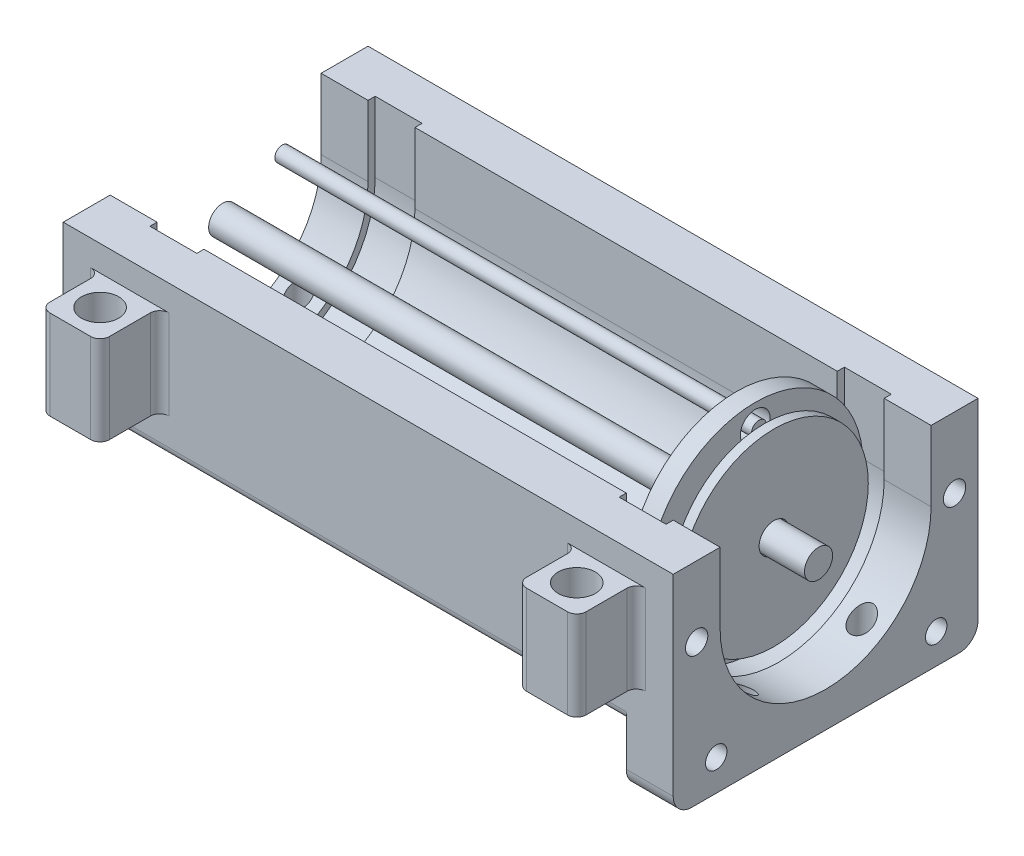
from build123d import *

# Parameters (mm, degrees)
SKETCH1_R             = 2.38125
BOSS_EXTRUDE1_DEPTH   = 45
SKETCH3_R             = 23
SKETCH3_R_2           = 3.175
BOSS_EXTRUDE2_DEPTH   = 4
SKETCH17_R            = 20.1
SKETCH17_R_2          = 3.175
BOSS_EXTRUDE4_DEPTH   = 2
SKETCH19_R            = 3
BOSS_EXTRUDE6_DEPTH   = 63.5
SKETCH20_R            = 1.5875
BOSS_EXTRUDE7_DEPTH   = 50.8
BOSS_EXTRUDE7_2_DEPTH = 50.8
BOSS_EXTRUDE7_3_DEPTH = 50.8
BOSS_EXTRUDE7_4_DEPTH = 50.8
BOSS_EXTRUDE8_START   = 10
SKETCH21_R            = 2.38125
BOSS_EXTRUDE8_DEPTH   = 10
BOSS_EXTRUDE9_START   = 10
SKETCH23_R            = 2.38125
SKETCH23_R_2          = 2.286
BOSS_EXTRUDE9_DEPTH   = 10
SKETCH24_R            = 2.38125
CUT_EXTRUDE1_DEPTH    = 50
SKETCH25_R            = 2.38125
BOSS_EXTRUDE10_DEPTH  = 10
SKETCH27_R            = 2.38125
BOSS_EXTRUDE11_DEPTH  = 10
SKETCH29_W            = 12.7
SKETCH29_H            = 19.05
BOSS_EXTRUDE12_DEPTH  = 12.7
SKETCH30_R            = 3.96875
CUT_EXTRUDE2_DEPTH    = 40
FILLET1_R             = 2


with BuildPart() as part:
    # Sketch1 → Boss-Extrude1 (new, symmetric)
    with BuildSketch(Plane(origin=(0, 0, 0), x_dir=(0, 0, -1), z_dir=(1, 0, 0))):
        with BuildLine():
            Line((-22.48125, 0), (-22.48125, 15))
            Line((-22.48125, 15), (-32.48125, 15))
            Line((-32.48125, 15), (-32.48125, -15.371))
            ThreePointArc((-32.48125, -15.371), (-31.895463562, -16.785213562), (-30.48125, -17.371))
            Line((-30.48125, -17.371), (-23.31225, -17.371))
            ThreePointArc((-23.31225, -17.371), (-19.069609313, -19.128359313), (-17.31225, -23.371))
            Line((-17.31225, -23.371), (-17.31225, -28))
            ThreePointArc((-17.31225, -28), (-16.726463562, -29.414213562), (-15.31225, -30))
            Line((-15.31225, -30), (15.42975, -30))
            ThreePointArc((15.42975, -30), (16.843963562, -29.414213562), (17.42975, -28))
            Line((17.42975, -28), (17.42975, -23.371))
            ThreePointArc((17.42975, -23.371), (19.187109313, -19.128359313), (23.42975, -17.371))
            Line((23.42975, -17.371), (30.05875, -17.371))
            Line((30.05875, -17.371), (30.48125, -17.371))
            ThreePointArc((30.48125, -17.371), (31.895463562, -16.785213562), (32.48125, -15.371))
            Line((32.48125, -15.371), (32.48125, 15))
            Line((32.48125, 15), (22.48125, 15))
            Line((22.48125, 15), (22.48125, 0))
            ThreePointArc((22.48125, 0), (0, -22.48125), (-22.48125, 0))
        make_face()
        with Locations(Location((-27.48125, 0, 0), (0, 0, 180))):
            Circle(SKETCH1_R, mode=Mode.SUBTRACT)
        with Locations(Location((27.48125, 0, 0), (0, 0, 180))):
            Circle(SKETCH1_R, mode=Mode.SUBTRACT)
    extrude(amount=BOSS_EXTRUDE1_DEPTH, both=True)

    # Sketch21 → Boss-Extrude8 (add)
    with BuildSketch(Plane(origin=(45, 0, 0), x_dir=(0, 0, -1), z_dir=(1, 0, 0)).offset(BOSS_EXTRUDE8_START)):
        with BuildLine():
            Line((-24, 0), (-24, 15))
            Line((-24, 15), (-32.48125, 15))
            Line((-32.48125, 15), (-32.48125, -15.371))
            ThreePointArc((-32.48125, -15.371), (-31.895463562, -16.785213562), (-30.48125, -17.371))
            Line((-30.48125, -17.371), (-23.31225, -17.371))
            ThreePointArc((-23.31225, -17.371), (-19.069609313, -19.128359313), (-17.31225, -23.371))
            Line((-17.31225, -23.371), (-17.31225, -28))
            ThreePointArc((-17.31225, -28), (-16.726463562, -29.414213562), (-15.31225, -30))
            Line((-15.31225, -30), (15.42975, -30))
            ThreePointArc((15.42975, -30), (16.843963562, -29.414213562), (17.42975, -28))
            Line((17.42975, -28), (17.42975, -23.371))
            ThreePointArc((17.42975, -23.371), (19.187109313, -19.128359313), (23.42975, -17.371))
            Line((23.42975, -17.371), (30.05875, -17.371))
            Line((30.05875, -17.371), (30.48125, -17.371))
            ThreePointArc((30.48125, -17.371), (31.895463562, -16.785213562), (32.48125, -15.371))
            Line((32.48125, -15.371), (32.48125, 15))
            Line((32.48125, 15), (24, 15))
            Line((24, 15), (24, 0))
            ThreePointArc((24, 0), (0, -24), (-24, 0))
        make_face()
        with Locations(Location((-27.48125, 0, 0), (0, 0, 180))):
            Circle(SKETCH21_R, mode=Mode.SUBTRACT)
        with Locations(Location((27.48125, 0, 0), (0, 0, 180))):
            Circle(SKETCH21_R, mode=Mode.SUBTRACT)
    extrude(amount=-BOSS_EXTRUDE8_DEPTH)

    # Sketch23 → Boss-Extrude9 (add)
    with BuildSketch(Plane(origin=(55, 0, 0), x_dir=(0, 0, -1), z_dir=(1, 0, 0)).offset(BOSS_EXTRUDE9_START)):
        with BuildLine():
            Line((-22.48125, 0), (-22.48125, 15))
            Line((-22.48125, 15), (-32.48125, 15))
            Line((-32.48125, 15), (-32.48125, -26))
            ThreePointArc((-32.48125, -26), (-31.309677125, -28.828427125), (-28.48125, -30))
            Line((-28.48125, -30), (28.48125, -30))
            ThreePointArc((28.48125, -30), (31.309677125, -28.828427125), (32.48125, -26))
            Line((32.48125, -26), (32.48125, 15))
            Line((32.48125, 15), (22.48125, 15))
            Line((22.48125, 15), (22.48125, 0))
            ThreePointArc((22.48125, 0), (0, -22.48125), (-22.48125, 0))
        make_face()
        with Locations(Location((-27.48125, 0, 0), (0, 0, 180))):
            Circle(SKETCH23_R, mode=Mode.SUBTRACT)
        with Locations(Location((27.48125, 0, 0), (0, 0, 180))):
            Circle(SKETCH23_R, mode=Mode.SUBTRACT)
        with Locations((-23.31225, -23.371)):
            Circle(SKETCH23_R_2, mode=Mode.SUBTRACT)
        with Locations((23.5712, -23.5712)):
            Circle(SKETCH23_R_2, mode=Mode.SUBTRACT)
    extrude(amount=-BOSS_EXTRUDE9_DEPTH)

    # Sketch24 → Cut-Extrude1 (cut)
    with BuildSketch(Plane.XZ.offset(30)):
        with Locations(Location((60, 12.7, 0), (0, 0, 270))):
            Circle(SKETCH24_R)
        with Locations(Location((60, -12.7, 0), (0, 0, 270))):
            Circle(SKETCH24_R)
    cut_extrude1 = extrude(amount=-CUT_EXTRUDE1_DEPTH, mode=Mode.SUBTRACT)

    # Sketch25 → Boss-Extrude10 (add)
    with BuildSketch(Plane.ZY.offset(45)):
        with BuildLine():
            Line((-24, 0), (-24, 15))
            Line((-24, 15), (-32.48125, 15))
            Line((-32.48125, 15), (-32.48125, -15.371))
            ThreePointArc((-32.48125, -15.371), (-31.895463562, -16.785213562), (-30.48125, -17.371))
            Line((-30.48125, -17.371), (-23.31225, -17.371))
            ThreePointArc((-23.31225, -17.371), (-19.069609313, -19.128359313), (-17.31225, -23.371))
            Line((-17.31225, -23.371), (-17.31225, -28))
            ThreePointArc((-17.31225, -28), (-16.726463562, -29.414213562), (-15.31225, -30))
            Line((-15.31225, -30), (15.42975, -30))
            ThreePointArc((15.42975, -30), (16.843963562, -29.414213562), (17.42975, -28))
            Line((17.42975, -28), (17.42975, -23.371))
            ThreePointArc((17.42975, -23.371), (19.187109313, -19.128359313), (23.42975, -17.371))
            Line((23.42975, -17.371), (30.05875, -17.371))
            Line((30.05875, -17.371), (30.48125, -17.371))
            ThreePointArc((30.48125, -17.371), (31.895463562, -16.785213562), (32.48125, -15.371))
            Line((32.48125, -15.371), (32.48125, 15))
            Line((32.48125, 15), (24, 15))
            Line((24, 15), (24, 0))
            ThreePointArc((24, 0), (0, -24), (-24, 0))
        make_face()
        with Locations((-27.48125, 0)):
            Circle(SKETCH25_R, mode=Mode.SUBTRACT)
        with Locations((27.48125, 0)):
            Circle(SKETCH25_R, mode=Mode.SUBTRACT)
    extrude(amount=BOSS_EXTRUDE10_DEPTH)

    # Sketch27 → Boss-Extrude11 (add)
    with BuildSketch(Plane.ZY.offset(55)):
        with BuildLine():
            Line((-22.48125, 0), (-22.48125, 15))
            Line((-22.48125, 15), (-32.48125, 15))
            Line((-32.48125, 15), (-32.48125, -15.371))
            ThreePointArc((-32.48125, -15.371), (-31.895463562, -16.785213562), (-30.48125, -17.371))
            Line((-30.48125, -17.371), (-23.31225, -17.371))
            ThreePointArc((-23.31225, -17.371), (-19.069609313, -19.128359313), (-17.31225, -23.371))
            Line((-17.31225, -23.371), (-17.31225, -28))
            ThreePointArc((-17.31225, -28), (-16.726463562, -29.414213562), (-15.31225, -30))
            Line((-15.31225, -30), (15.42975, -30))
            ThreePointArc((15.42975, -30), (16.843963562, -29.414213562), (17.42975, -28))
            Line((17.42975, -28), (17.42975, -23.371))
            ThreePointArc((17.42975, -23.371), (19.187109313, -19.128359313), (23.42975, -17.371))
            Line((23.42975, -17.371), (30.05875, -17.371))
            Line((30.05875, -17.371), (30.48125, -17.371))
            ThreePointArc((30.48125, -17.371), (31.895463562, -16.785213562), (32.48125, -15.371))
            Line((32.48125, -15.371), (32.48125, 15))
            Line((32.48125, 15), (22.48125, 15))
            Line((22.48125, 15), (22.48125, 0))
            ThreePointArc((22.48125, 0), (0, -22.48125), (-22.48125, 0))
        make_face()
        with Locations((-27.48125, 0)):
            Circle(SKETCH27_R, mode=Mode.SUBTRACT)
        with Locations((27.48125, 0)):
            Circle(SKETCH27_R, mode=Mode.SUBTRACT)
    extrude(amount=BOSS_EXTRUDE11_DEPTH)

    # Mirror6: Cut-Extrude1 across plane
    add(cut_extrude1.mirror(Plane(origin=(0, 0, 0), x_dir=(0, 0, 1), z_dir=(1, 0, 0))), mode=Mode.SUBTRACT)

    # Sketch29 → Boss-Extrude12 (add)
    with BuildSketch(Plane.XY.offset(32.48125)):
        with Locations((50.8, 0)):
            Rectangle(SKETCH29_W, SKETCH29_H)
    boss_extrude12 = extrude(amount=BOSS_EXTRUDE12_DEPTH)

    # Sketch30 → Cut-Extrude2 (cut)
    with BuildSketch(Plane(origin=(0, 9.525, 0), x_dir=(1, 0, 0), z_dir=(0, 1, 0))):
        with Locations(Location((50.8, -38.83125, 0), (0, 0, 270))):
            Circle(SKETCH30_R)
    cut_extrude2 = extrude(amount=-CUT_EXTRUDE2_DEPTH, mode=Mode.SUBTRACT)

    # Mirror7: Boss-Extrude12, Cut-Extrude2 across plane
    add(boss_extrude12.mirror(Plane(origin=(0, 0, 0), x_dir=(0, 0, 1), z_dir=(1, 0, 0))))
    add(cut_extrude2.mirror(Plane(origin=(0, 0, 0), x_dir=(0, 0, 1), z_dir=(1, 0, 0))), mode=Mode.SUBTRACT)

    # Fillet1
    fillet1_edges = [part.edges().sort_by_distance(p)[0] for p in [
        (57.15, 0, 45.18125),
        (44.45, 0, 32.48125),
        (44.45, 0, 45.18125),
        (57.15, 0, 32.48125),
        (-57.15, 0, 32.48125),
        (-44.45, 0, 45.18125),
        (-57.15, 0, 45.18125),
        (-44.45, 0, 32.48125),
    ]]
    fillet(fillet1_edges, radius=FILLET1_R)


with BuildPart() as body_2:
    # Sketch3 → Boss-Extrude2 (new body)
    with BuildSketch(Plane(origin=(46, 0, 0), x_dir=(0, 0, -1), z_dir=(1, 0, 0))):
        Circle(SKETCH3_R)
        Circle(SKETCH3_R_2, mode=Mode.SUBTRACT)
        with Locations((0, 18.5125)):
            Circle(SKETCH3_R_2, mode=Mode.SUBTRACT)
        with Locations((-18.5125, 0)):
            Circle(SKETCH3_R_2, mode=Mode.SUBTRACT)
        with Locations((0, -18.5125)):
            Circle(SKETCH3_R_2, mode=Mode.SUBTRACT)
        with Locations((18.5125, 0)):
            Circle(SKETCH3_R_2, mode=Mode.SUBTRACT)
    extrude(amount=BOSS_EXTRUDE2_DEPTH)


with BuildPart() as body_3:
    # Sketch17 → Boss-Extrude4 (new body)
    with BuildSketch(Plane(origin=(52, 0, 0), x_dir=(0, 0, -1), z_dir=(1, 0, 0))):
        Circle(SKETCH17_R)
        Circle(SKETCH17_R_2, mode=Mode.SUBTRACT)
    extrude(amount=BOSS_EXTRUDE4_DEPTH)


with BuildPart() as body_4:
    # Sketch19 → Boss-Extrude6 (new, symmetric)
    with BuildSketch(Plane(origin=(0, 0, 0), x_dir=(0, 0, -1), z_dir=(1, 0, 0))):
        Circle(SKETCH19_R)
    extrude(amount=BOSS_EXTRUDE6_DEPTH, both=True)


with BuildPart() as body_5:
    # Sketch20 → Boss-Extrude7 (new, symmetric)
    with BuildSketch(Plane(origin=(0, 0, 0), x_dir=(0, 0, -1), z_dir=(1, 0, 0))):
        with Locations((0, 18.5125)):
            Circle(SKETCH20_R)
    extrude(amount=BOSS_EXTRUDE7_DEPTH, both=True)


with BuildPart() as body_6:
    # Sketch20 → Boss-Extrude7 2 (new, symmetric)
    with BuildSketch(Plane(origin=(0, 0, 0), x_dir=(0, 0, -1), z_dir=(1, 0, 0))):
        with Locations((18.5125, 0)):
            Circle(SKETCH20_R)
    extrude(amount=BOSS_EXTRUDE7_2_DEPTH, both=True)


with BuildPart() as body_7:
    # Sketch20 → Boss-Extrude7 3 (new, symmetric)
    with BuildSketch(Plane(origin=(0, 0, 0), x_dir=(0, 0, -1), z_dir=(1, 0, 0))):
        with Locations((0, -18.5125)):
            Circle(SKETCH20_R)
    extrude(amount=BOSS_EXTRUDE7_3_DEPTH, both=True)


with BuildPart() as body_8:
    # Sketch20 → Boss-Extrude7 4 (new, symmetric)
    with BuildSketch(Plane(origin=(0, 0, 0), x_dir=(0, 0, -1), z_dir=(1, 0, 0))):
        with Locations((-18.5125, 0)):
            Circle(SKETCH20_R)
    extrude(amount=BOSS_EXTRUDE7_4_DEPTH, both=True)


solid = Compound([part.part, body_2.part, body_3.part, body_4.part, body_5.part, body_6.part, body_7.part, body_8.part])
